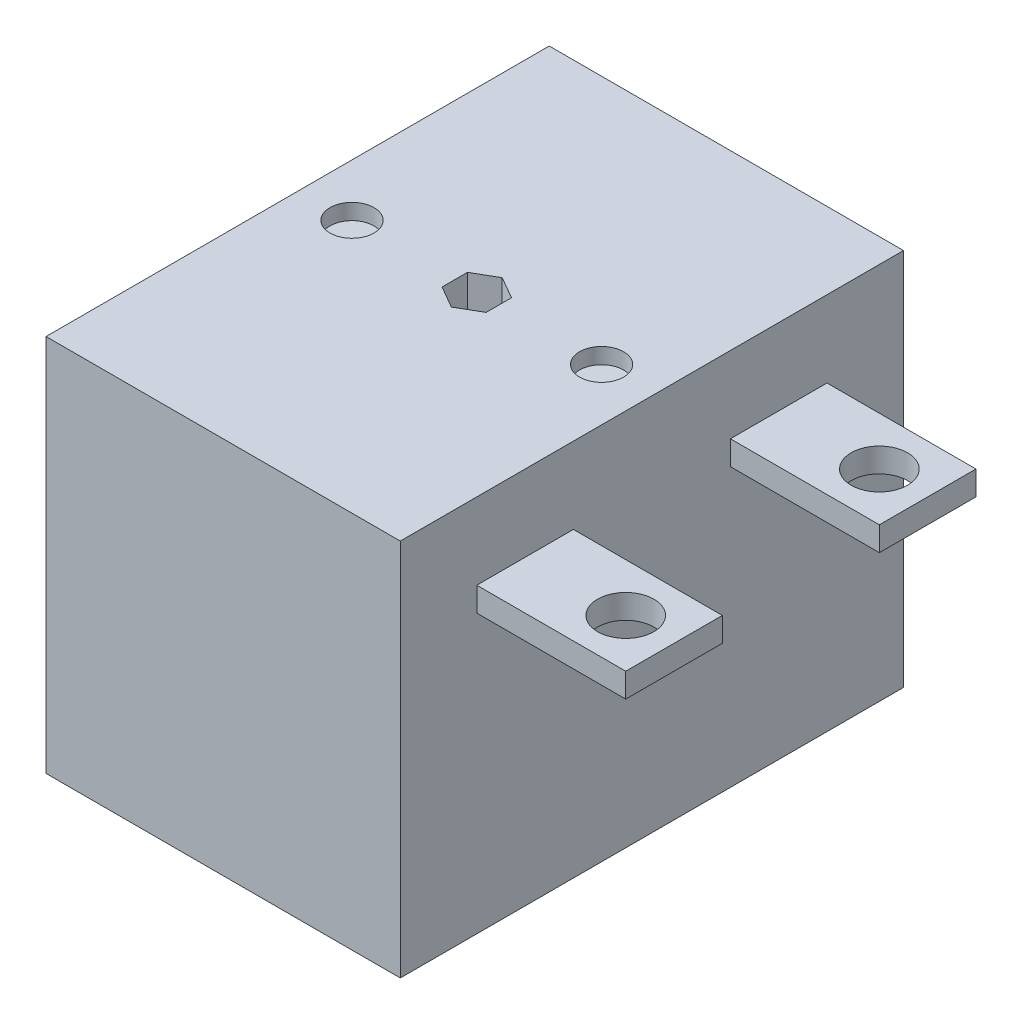
from build123d import *

# Parameters (mm, degrees)
SKETCH1_W           = 22.352
SKETCH1_H           = 23.876
BOSS_EXTRUDE1_DEPTH = 31.75
CUT_EXTRUDE1_DEPTH  = 4.572
SKETCH2_3_R         = 1.3890625
CUT_EXTRUDE2_DEPTH  = 1
SKETCH4_W           = 6.096
SKETCH4_H           = 1.524
BOSS_EXTRUDE2_DEPTH = 9.398
CUT_EXTRUDE3_REACH  = 50.775
SKETCH5_R           = 1.778


with BuildPart() as part:
    # Sketch1 → Boss-Extrude1 (new body)
    with BuildSketch(Plane.XY):
        with Locations((11.176, 11.938)):
            Rectangle(SKETCH1_W, SKETCH1_H)
    extrude(amount=BOSS_EXTRUDE1_DEPTH)

    # Sketch2 → Cut-Extrude1 (cut)
    with BuildSketch(Plane(origin=(0, 23.876, 0), x_dir=(1, 0, 0), z_dir=(0, 1, 0))):
        Polygon((9.7869375, -16.549975608), (11.176, -17.351951217), (12.5650625, -16.549975608), (12.5650625, -14.946024392), (11.176, -14.144048783), (9.7869375, -14.946024392), align=None)
    extrude(amount=-CUT_EXTRUDE1_DEPTH, mode=Mode.SUBTRACT)

    # Sketch2<3> → Cut-Extrude2 (cut)
    with BuildSketch(Plane(origin=(0, 23.876, 0), x_dir=(1, 0, 0), z_dir=(0, 1, 0))):
        with Locations((3.302, -15.748)):
            Circle(SKETCH2_3_R)
        with Locations((19.05, -15.748)):
            Circle(SKETCH2_3_R)
    extrude(amount=-CUT_EXTRUDE2_DEPTH, mode=Mode.SUBTRACT)

    # Sketch4 → Boss-Extrude2 (add)
    with BuildSketch(Plane(origin=(22.352, 0, 0), x_dir=(0, 0, -1), z_dir=(1, 0, 0))):
        with Locations((-23.876, 18.288)):
            Rectangle(SKETCH4_W, SKETCH4_H)
        with Locations((-7.874, 18.288)):
            Rectangle(SKETCH4_W, SKETCH4_H)
    extrude(amount=BOSS_EXTRUDE2_DEPTH)

    # Sketch5 → Cut-Extrude3 (cut, up to next)
    with BuildSketch(Plane(origin=(0, 19.05, 0), x_dir=(1, 0, 0), z_dir=(0, 1, 0)), mode=Mode.PRIVATE) as cut_extrude3_sk1:
        with Locations((28.702, -23.876)):
            Circle(SKETCH5_R)
    cut_extrude3_tool1 = extrude(cut_extrude3_sk1.sketch, amount=-CUT_EXTRUDE3_REACH, mode=Mode.PRIVATE) & part.part
    # Sketch5 → Cut-Extrude3 (cut, up to next)
    with BuildSketch(Plane(origin=(0, 19.05, 0), x_dir=(1, 0, 0), z_dir=(0, 1, 0)), mode=Mode.PRIVATE) as cut_extrude3_sk2:
        with Locations((28.702, -7.874)):
            Circle(SKETCH5_R)
    cut_extrude3_tool2 = extrude(cut_extrude3_sk2.sketch, amount=-CUT_EXTRUDE3_REACH, mode=Mode.PRIVATE) & part.part
    add(cut_extrude3_tool1.solids().sort_by_distance((28.702, 19.05, 23.876))[0], mode=Mode.SUBTRACT)
    add(cut_extrude3_tool2.solids().sort_by_distance((28.702, 19.05, 7.874))[0], mode=Mode.SUBTRACT)


solid = part.part
